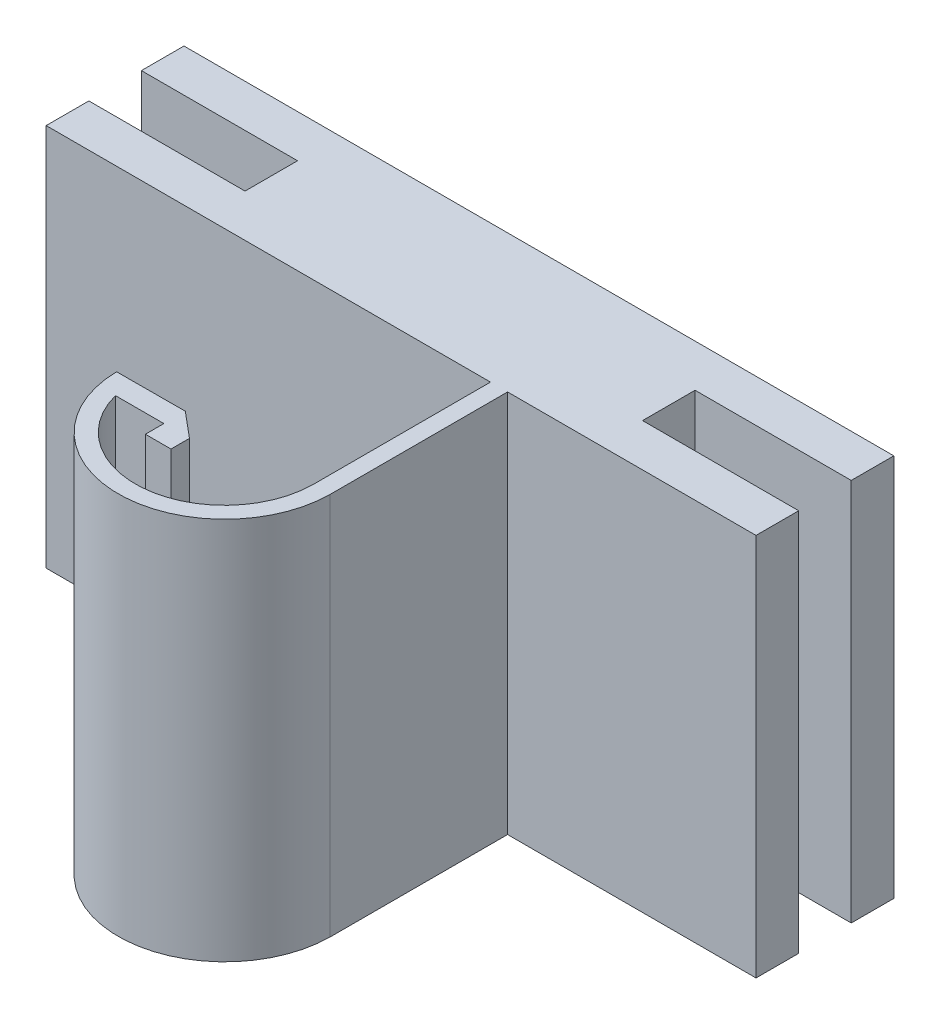
from build123d import *

# Parameters (mm, degrees)
BOSS_EXTRUDE2_DEPTH = 27


with BuildPart() as part:
    # Sketch2 → Boss-Extrude2 (new body)
    with BuildSketch(Plane(origin=(0, 0, 0), x_dir=(1, 0, 0), z_dir=(0, 1, 0))):
        with BuildLine():
            Line((-28.349494605, 21.964136687), (-17.349494605, 21.964136687))
            Line((-17.349494605, 21.964136687), (-17.349494605, 25.664136687))
            Line((-17.349494605, 25.664136687), (-28.349494605, 25.664136687))
            Line((-28.349494605, 25.664136687), (-28.349494605, 28.664136687))
            Line((-28.349494605, 28.664136687), (21.650505395, 28.664136687))
            Line((21.650505395, 28.664136687), (21.650505395, 25.664136687))
            Line((21.650505395, 25.664136687), (10.650505395, 25.664136687))
            Line((10.650505395, 25.664136687), (10.650505395, 21.964136687))
            Line((10.650505395, 21.964136687), (21.650505395, 21.964136687))
            Line((21.650505395, 21.964136687), (21.650505395, 18.957031621))
            Line((21.650505395, 18.957031621), (4.150505395, 18.957031621))
            Line((4.150505395, 18.957031621), (4.150505395, 6.457031621))
            ThreePointArc((4.150505395, 6.457031621), (-3.329004451, -0.970516956), (-10.847714263, 6.41734797))
            Line((-10.847714263, 6.41734797), (-6.026180838, 6.432389281))
            Line((-6.026180838, 6.432389281), (-4.222493535, 4.923226245))
            Line((-4.222493535, 4.923226245), (-4.222493535, 3.622157415))
            Line((-4.222493535, 3.622157415), (-6.026180838, 3.622157415))
            Line((-6.026180838, 3.622157415), (-6.026180838, 4.923226245))
            Line((-6.026180838, 4.923226245), (-9.437915177, 4.923226245))
            ThreePointArc((-9.437915177, 4.923226245), (-2.58302441, 0.278615253), (2.947813029, 6.440739557))
            Line((2.947813029, 6.440739557), (2.947813029, 18.957031621))
            Line((2.947813029, 18.957031621), (-28.349494605, 18.957031621))
            Line((-28.349494605, 18.957031621), (-28.349494605, 21.964136687))
        make_face()
    extrude(amount=BOSS_EXTRUDE2_DEPTH)


solid = part.part
